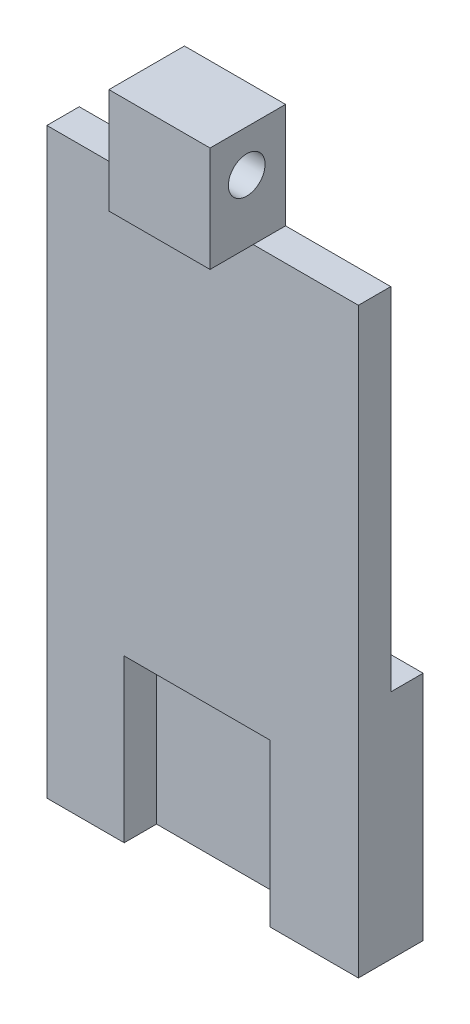
from build123d import *

# Parameters (mm, degrees)
BOSS_EXTRUDE1_DEPTH = 3
SKETCH3_W           = 9.37333333
SKETCH3_H           = 9.75
BOSS_EXTRUDE2_DEPTH = 4
SKETCH5_W           = 28.87333333
SKETCH5_H           = 21.46504359
BOSS_EXTRUDE3_DEPTH = 3
SKETCH6_R           = 1.7
CUT_EXTRUDE1_DEPTH  = 10


with BuildPart() as part:
    # Sketch1 → Boss-Extrude1 (new body)
    with BuildSketch(Plane.XY):
        Polygon((-4.686666665, 8.42561874), (-14.436666665, 8.42561874), (-14.436666665, -30.57438126), (-14.436666665, -45.57438126), (-7.270097193, -45.57438126), (-7.270097193, -30.57438126), (6.249902807, -30.57438126), (6.249902807, -45.57438126), (14.436666665, -45.57438126), (14.436666665, -30.57438126), (14.436666665, 8.42561874), (4.686666665, 8.42561874), (4.686666665, 18.17561874), (-4.686666665, 18.17561874), align=None)
    extrude(amount=BOSS_EXTRUDE1_DEPTH)

    # Sketch3 → Boss-Extrude2 (add)
    with BuildSketch(Plane.XY.offset(3)):
        with Locations((0, 13.30061874)):
            Rectangle(SKETCH3_W, SKETCH3_H)
    extrude(amount=BOSS_EXTRUDE2_DEPTH)

    # Sketch5 → Boss-Extrude3 (add)
    with BuildSketch(Plane.XY):
        with Locations((0, -34.841859465)):
            Rectangle(SKETCH5_W, SKETCH5_H)
    extrude(amount=-BOSS_EXTRUDE3_DEPTH)

    # Sketch6 → Cut-Extrude1 (cut)
    with BuildSketch(Plane.ZY.offset(4.686666665)):
        with Locations(Location((3.6, 14.31561874, 0), (0, 0, 270))):
            Circle(SKETCH6_R)
    extrude(amount=-CUT_EXTRUDE1_DEPTH, mode=Mode.SUBTRACT)


solid = part.part
